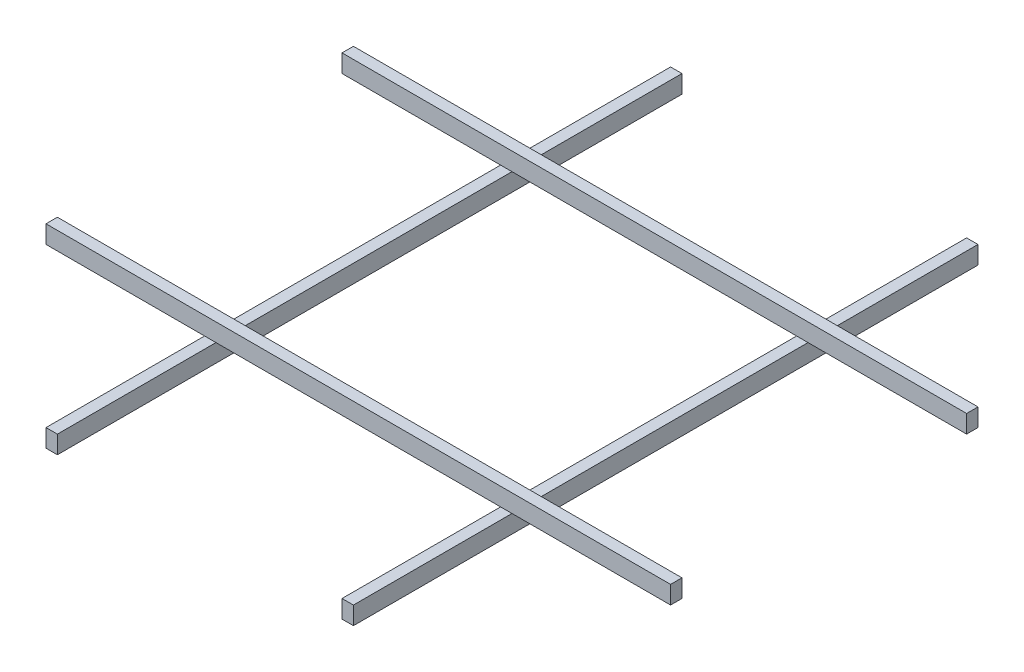
from build123d import *

# Parameters (mm, degrees)
SKETCH1_W              = 88.9
SKETCH1_H              = 139.7
PROFILES_4X6_1_DEPTH   = 4876.8
SKETCH1_ON_SEGMENT_2_W = 88.9
SKETCH1_ON_SEGMENT_2_H = 139.7
PROFILES_4X6_1_2_DEPTH = 4876.8
SKETCH1_ON_SEGMENT_3_W = 88.9
SKETCH1_ON_SEGMENT_3_H = 139.7
PROFILES_4X6_1_3_DEPTH = 4876.8
SKETCH1_ON_SEGMENT_4_W = 88.9
SKETCH1_ON_SEGMENT_4_H = 139.7
PROFILES_4X6_1_4_DEPTH = 4876.8


with BuildPart() as part:
    # Sketch1 → Profiles 4X6(1) (new body)
    with BuildSketch(Plane(origin=(977.9, 0, 0), x_dir=(-1, 0, 0), z_dir=(0, 0, -1))):
        Rectangle(SKETCH1_W, SKETCH1_H)
    extrude(amount=PROFILES_4X6_1_DEPTH)


with BuildPart() as body_2:
    # Sketch1 on segment 2 (carried to segment 2) → Profiles 4X6_1 2 (new body)
    with BuildSketch(Plane(origin=(3289.3, 0, 0), x_dir=(-1, 0, 0), z_dir=(0, 0, -1))):
        Rectangle(SKETCH1_ON_SEGMENT_2_W, SKETCH1_ON_SEGMENT_2_H)
    extrude(amount=PROFILES_4X6_1_2_DEPTH)


with BuildPart() as body_3:
    # Sketch1 on segment 3 (carried to segment 3) → Profiles 4X6_1 3 (new body)
    with BuildSketch(Plane(origin=(-304.8, 139.7, -3594.1), x_dir=(0, 0, -1), z_dir=(1, 0, 0))):
        Rectangle(SKETCH1_ON_SEGMENT_3_W, SKETCH1_ON_SEGMENT_3_H)
    extrude(amount=PROFILES_4X6_1_3_DEPTH)


with BuildPart() as body_4:
    # Sketch1 on segment 4 (carried to segment 4) → Profiles 4X6_1 4 (new body)
    with BuildSketch(Plane(origin=(4572, 139.7, -1282.7), x_dir=(0, 0, 1), z_dir=(-1, 0, 0))):
        Rectangle(SKETCH1_ON_SEGMENT_4_W, SKETCH1_ON_SEGMENT_4_H)
    extrude(amount=PROFILES_4X6_1_4_DEPTH)


solid = Compound([part.part, body_2.part, body_3.part, body_4.part])
